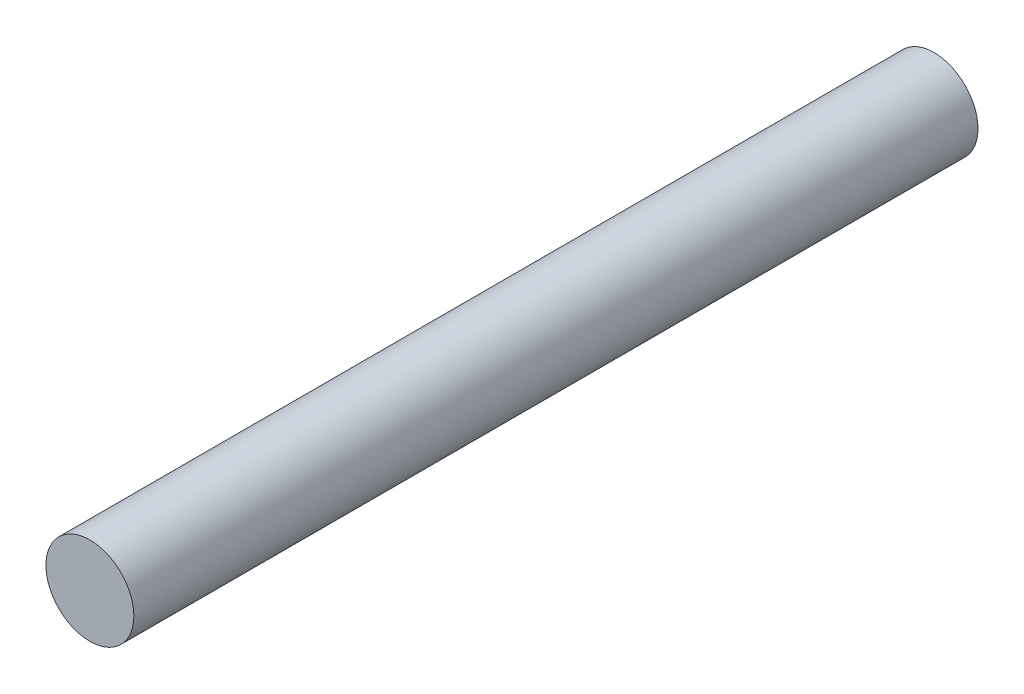
from build123d import *

# Parameters (mm, degrees)
SKIZZE1_R                       = 1.25
AUFSATZ_LINEAR_AUSTRAGEN1_DEPTH = 24


with BuildPart() as part:
    # Skizze1 → Aufsatz-Linear austragen1 (new body)
    with BuildSketch(Plane.XY):
        with Locations((-4.179870945, 1.247197002)):
            Circle(SKIZZE1_R)
    extrude(amount=AUFSATZ_LINEAR_AUSTRAGEN1_DEPTH)


solid = part.part
